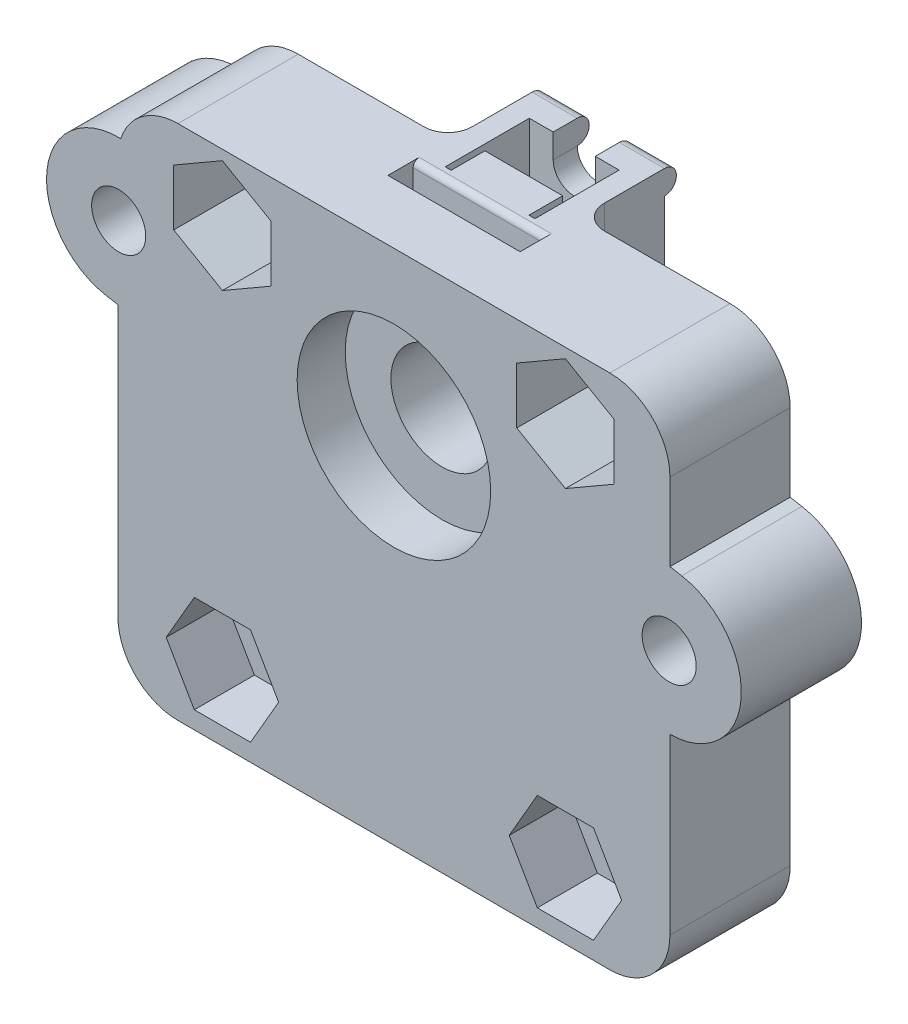
from build123d import *

# Parameters (mm, degrees)
BOSS_EXTRUDE1_DEPTH      = 13.5
BOSS_EXTRUDE2_DEPTH      = 18.5
BOSS_EXTRUDE3_DEPTH      = 5
SKETCH4_W                = 45.922011884
SKETCH4_H                = 20
BOSS_EXTRUDE4_DEPTH      = 13.5
SKETCH2_R                = 4.25
CUT_EXTRUDE1_DEPTH       = 268.629329099
SKETCH6_R                = 8.05
CUT_EXTRUDE3_DEPTH       = 14
BOSS_EXTRUDE5_DEPTH      = 13.5
CUT_EXTRUDE5_REACH       = 210.1
CUT_EXTRUDE5_END_RADIUS  = 45
SKETCH8_R                = 9
CUT_EXTRUDE6_REACH       = 210.1
SKETCH10_R               = 4
SKETCH11_R               = 8
CUT_EXTRUDE7_DEPTH       = 4
SKETCH18_R               = 11
CUT_EXTRUDE9_DEPTH       = 47
CUT_EXTRUDE11_DEPTH      = 268.629329099
CUT_EXTRUDE11_DEPTH_BACK = 268.629329099
SKETCH20_W               = 45.922011884
SKETCH20_H               = 204.425421037
SKETCH21_W               = 45.922011884
SKETCH21_H               = 10
BOSS_EXTRUDE6_DEPTH      = 16
M5_CLEARANCE_HOLE1_D     = 5.5
CUT_EXTRUDE12_DEPTH      = 5
LPATTERN2_COUNT          = 2
LPATTERN2_PITCH          = 32
LPATTERN2_COPY_1_D       = 5.5
CUT_EXTRUDE13_START      = -4
SKETCH25_R               = 2.75
CUT_EXTRUDE13_DEPTH      = 39.396436099
SKETCH26_W               = 45.922011884
SKETCH26_H               = 10
CUT_EXTRUDE14_DEPTH      = 271.429672547
FILLET1_R                = 5
SKETCH30_W               = 11
SKETCH30_H               = 7
BOSS_EXTRUDE8_DEPTH      = 5
CUT_EXTRUDE15_DEPTH      = 5
FILLET3_R                = 2
BOSS_EXTRUDE9_DEPTH      = 2
BOSS_EXTRUDE10_DEPTH     = 3.75
SKETCH36_W               = 11
SKETCH36_H               = 2.1
CUT_EXTRUDE17_DEPTH      = 2.5
FILLET4_R                = 0.5
BOSS_EXTRUDE11_START     = -10
BOSS_EXTRUDE11_DEPTH     = 10
CUT_EXTRUDE18_DEPTH      = 4
M4_CLEARANCE_HOLE1_D     = 4.5


with BuildPart() as part:
    # Sketch1 → Boss-Extrude1 (new, symmetric)
    with BuildSketch(Plane(origin=(0, 0, 0), x_dir=(1, 0, 0), z_dir=(0, 1, 0))):
        with BuildLine():
            ThreePointArc((17.220754456, -41.574578963), (0, -45), (-17.220754456, -41.574578963))
            Line((-17.220754456, -41.574578963), (-22.961005942, -55.432771951))
            ThreePointArc((-22.961005942, -55.432771951), (0, -60), (22.961005942, -55.432771951))
            Line((22.961005942, -55.432771951), (17.220754456, -41.574578963))
        make_face()
    extrude(amount=BOSS_EXTRUDE1_DEPTH, both=True)

    # Sketch1<3> → Boss-Extrude2 (add, symmetric)
    with BuildSketch(Plane(origin=(0, 0, 0), x_dir=(1, 0, 0), z_dir=(0, 1, 0))):
        with BuildLine():
            ThreePointArc((19.134171618, -46.193976626), (0, -50), (-19.134171618, -46.193976626))
            Line((-19.134171618, -46.193976626), (-21.04758878, -50.813374288))
            ThreePointArc((-21.04758878, -50.813374288), (0, -55), (21.04758878, -50.813374288))
            Line((21.04758878, -50.813374288), (19.134171618, -46.193976626))
        make_face()
    extrude(amount=BOSS_EXTRUDE2_DEPTH, both=True)

    # Sketch3 → Boss-Extrude3 (add, symmetric)
    with BuildSketch(Plane.XZ):
        with BuildLine():
            Line((-22.961005942, 266), (-22.961005942, 55.432771951))
            ThreePointArc((-22.961005942, 55.432771951), (-20.481139434, 56.39612511), (-17.961005942, 57.248600555))
            Line((-17.961005942, 57.248600555), (-17.961005942, 246))
            Line((-17.961005942, 246), (17.961005942, 246))
            Line((17.961005942, 246), (17.961005942, 57.248600555))
            ThreePointArc((17.961005942, 57.248600555), (20.481139434, 56.39612511), (22.961005942, 55.432771951))
            Line((22.961005942, 55.432771951), (22.961005942, 266))
            Line((22.961005942, 266), (-22.961005942, 266))
        make_face()
    extrude(amount=BOSS_EXTRUDE3_DEPTH, both=True)

    # Sketch4 → Boss-Extrude4 (add, symmetric)
    with BuildSketch(Plane(origin=(0, 0, 0), x_dir=(1, 0, 0), z_dir=(0, 1, 0))):
        with Locations((0, -256)):
            Rectangle(SKETCH4_W, SKETCH4_H)
    extrude(amount=BOSS_EXTRUDE4_DEPTH, both=True)

    # Sketch2 → Cut-Extrude1 (cut, through all)
    with BuildSketch(Plane.XY):
        with Locations(Location((0, 0, 0), (0, 0, 180))):
            Circle(SKETCH2_R)
    extrude(amount=CUT_EXTRUDE1_DEPTH, mode=Mode.SUBTRACT)

    # Sketch6 → Cut-Extrude3 (cut)
    with BuildSketch(Plane.XY.offset(266)):
        Circle(SKETCH6_R)
    extrude(amount=-CUT_EXTRUDE3_DEPTH, mode=Mode.SUBTRACT)

    # Sketch9 → Boss-Extrude5 (add, symmetric)
    with BuildSketch(Plane(origin=(0, 0, 0), x_dir=(1, 0, 0), z_dir=(0, 1, 0))):
        with BuildLine():
            Line((-22.961005942, -55.432771951), (-22.961005942, -68))
            Line((-22.961005942, -68), (22.961005942, -68))
            Line((22.961005942, -68), (22.961005942, -55.432771951))
            ThreePointArc((22.961005942, -55.432771951), (0, -60), (-22.961005942, -55.432771951))
        make_face()
    extrude(amount=BOSS_EXTRUDE5_DEPTH, both=True)

    # Cut-Extrude5: up to this cylinder (the profile starts outside it)
    cut_extrude5_end = Plane(origin=(0, 0, 0), z_dir=(0, -1, 0)) * Cylinder(CUT_EXTRUDE5_END_RADIUS, 511.2, mode=Mode.PRIVATE)
    # Sketch8 → Cut-Extrude5 (cut, up to the surface)
    with BuildSketch(Plane.XY.offset(60), mode=Mode.PRIVATE) as cut_extrude5_sk1:
        Circle(SKETCH8_R)
    cut_extrude5_tool1 = extrude(cut_extrude5_sk1.sketch, amount=-CUT_EXTRUDE5_REACH, mode=Mode.PRIVATE) - cut_extrude5_end
    add(cut_extrude5_tool1.solids().sort_by_distance((0, 0, 60))[0], mode=Mode.SUBTRACT)

    # Sketch10 → Cut-Extrude6 (cut, up to next)
    with BuildSketch(Plane.XY.offset(60), mode=Mode.PRIVATE) as cut_extrude6_sk1:
        with Locations(Location((0, 0, 0), (0, 0, 180))):
            Circle(SKETCH10_R)
    cut_extrude6_tool1 = extrude(cut_extrude6_sk1.sketch, amount=CUT_EXTRUDE6_REACH, mode=Mode.PRIVATE) & part.part
    add(cut_extrude6_tool1.solids().sort_by_distance((0, 0, 60))[0], mode=Mode.SUBTRACT)

    # Sketch11 → Cut-Extrude7 (cut)
    with BuildSketch(Plane.XY.offset(68)):
        Circle(SKETCH11_R)
    extrude(amount=-CUT_EXTRUDE7_DEPTH, mode=Mode.SUBTRACT)

    # Sketch18 → Cut-Extrude9 (cut)
    with BuildSketch(Plane.XY):
        with Locations(Location((0, 0, 0), (0, 0, 180))):
            Circle(SKETCH18_R)
    extrude(amount=CUT_EXTRUDE9_DEPTH, mode=Mode.SUBTRACT)

    # Sketch20 → Cut-Extrude11 (cut, two sides: drawn at the far end of the back side and taken through both)
    with BuildSketch(Plane(origin=(0, 0, 0), x_dir=(1, 0, 0), z_dir=(0, 1, 0)).offset(-CUT_EXTRUDE11_DEPTH_BACK)):
        with Locations((0, -143.787289482)):
            Rectangle(SKETCH20_W, SKETCH20_H)
    extrude(amount=CUT_EXTRUDE11_DEPTH + CUT_EXTRUDE11_DEPTH_BACK, mode=Mode.SUBTRACT)

    # Sketch21 → Boss-Extrude6 (add)
    with BuildSketch(Plane.XZ.offset(13.5)):
        with Locations((0, 251)):
            Rectangle(SKETCH21_W, SKETCH21_H)
    extrude(amount=BOSS_EXTRUDE6_DEPTH)

    # M5 Clearance Hole1 (through all)
    with Locations(Plane(origin=(0, 0, 246), x_dir=(-1, 0, 0), z_dir=(0, 0, -1))):
        with Locations((-14.26606865, -24)):
            m5_clearance_hole1 = Hole(M5_CLEARANCE_HOLE1_D / 2)

    # Sketch24 → Cut-Extrude12 (cut)
    with BuildSketch(Plane.XY.offset(256)):
        Polygon((18.94260583, -24), (16.60433724, -19.95), (11.92780006, -19.95), (9.58953147, -24), (11.92780006, -28.05), (16.60433724, -28.05), align=None)
    cut_extrude12 = extrude(amount=-CUT_EXTRUDE12_DEPTH, mode=Mode.SUBTRACT)

    # Mirror1: M5 Clearance Hole1 across plane
    add(m5_clearance_hole1.mirror(Plane(origin=(0, 0, 0), x_dir=(0, 0, 1), z_dir=(1, 0, 0))), mode=Mode.SUBTRACT)

    # Mirror2: Cut-Extrude12 across plane
    add(cut_extrude12.mirror(Plane(origin=(0, 0, 0), x_dir=(0, 0, 1), z_dir=(1, 0, 0))), mode=Mode.SUBTRACT)

    # LPattern2: M5 Clearance Hole1 ×2
    with Locations(*[(0, i * LPATTERN2_PITCH, 0) for i in range(1, LPATTERN2_COUNT)]):
        add(m5_clearance_hole1, mode=Mode.SUBTRACT)

    # LPattern2 copy 1 (through all)
    with Locations(Plane(origin=(0, 32, 246), x_dir=(1, 0, 0), z_dir=(0, 0, -1))):
        with Locations((-14.26606865, 24)):
            Hole(LPATTERN2_COPY_1_D / 2)

    # Sketch25 → Cut-Extrude13 (cut, through all)
    # profile 1 of 2: a face of its own
    with BuildSketch(Plane(origin=(0, 0, 246), x_dir=(-1, 0, 0), z_dir=(0, 0, -1)).offset(CUT_EXTRUDE13_START)):
        Polygon((-10.21606865, 10.33826859), (-14.26606865, 12.67653718), (-18.31606865, 10.33826859), (-18.31606865, 5.66173141), (-14.26606865, 3.32346282), (-10.21606865, 5.66173141), align=None)
        with Locations((-14.26606865, 8)):
            Circle(SKETCH25_R, mode=Mode.SUBTRACT)
    # profile 2 of 2: a face of its own
    with BuildSketch(Plane(origin=(0, 0, 246), x_dir=(-1, 0, 0), z_dir=(0, 0, -1)).offset(CUT_EXTRUDE13_START)):
        with Locations((-14.26606865, 8)):
            Circle(SKETCH25_R)
    cut_extrude13 = extrude(amount=-CUT_EXTRUDE13_DEPTH, mode=Mode.SUBTRACT)

    # Mirror3: Cut-Extrude13 across plane
    add(cut_extrude13.mirror(Plane(origin=(0, 0, 0), x_dir=(0, 0, 1), z_dir=(1, 0, 0))), mode=Mode.SUBTRACT)

    # Sketch26 → Cut-Extrude14 (cut, through all)
    with BuildSketch(Plane(origin=(0, 13.5, 0), x_dir=(1, 0, 0), z_dir=(0, 1, 0))):
        with Locations((0, -261)):
            Rectangle(SKETCH26_W, SKETCH26_H)
    extrude(amount=-CUT_EXTRUDE14_DEPTH, mode=Mode.SUBTRACT)

    # Fillet1
    fillet1_edges = [part.edges().sort_by_distance(p)[0] for p in [
        (-22.961005942, -29.5, 251),
        (22.961005942, -29.5, 251),
        (22.961005942, 13.5, 251),
        (-22.961005942, 13.5, 251),
    ]]
    fillet(fillet1_edges, radius=FILLET1_R)

    # Sketch30 → Boss-Extrude8 (add)
    with BuildSketch(Plane(origin=(0, 0, 246), x_dir=(-1, 0, 0), z_dir=(0, 0, -1))):
        with Locations((0, 10)):
            Rectangle(SKETCH30_W, SKETCH30_H)
    extrude(amount=BOSS_EXTRUDE8_DEPTH)

    # Sketch31 → Cut-Extrude15 (cut)
    with BuildSketch(Plane(origin=(0, 13.5, 0), x_dir=(1, 0, 0), z_dir=(0, 1, 0))):
        Polygon((3.735, -241), (3.735, -248), (3.235, -248), (3.235, -245.2), (-3.235, -245.2), (-3.235, -248), (-3.735, -248), (-3.735, -241), align=None)
    extrude(amount=-CUT_EXTRUDE15_DEPTH, mode=Mode.SUBTRACT)

    # Fillet3
    fillet3_edges = [part.edges().sort_by_distance(p)[0] for p in [
        (-5.5, 10, 246),
        (5.5, 10, 246),
        (0, 6.5, 246),
    ]]
    fillet(fillet3_edges, radius=FILLET3_R)

    # Sketch32 → Boss-Extrude9 (add)
    with BuildSketch(Plane(origin=(0, 0, 241), x_dir=(-1, 0, 0), z_dir=(0, 0, -1))):
        Polygon((3.735, 13.5), (3.735, 8.5), (-3.735, 8.5), (-3.735, 13.5), (-5.5, 13.5), (-5.5, 6.5), (5.5, 6.5), (5.5, 13.5), align=None)
        with BuildLine():
            ThreePointArc((1.75, 11.5), (0, 9.75), (-1.75, 11.5))
            Line((-1.75, 11.5), (-1.75, 13.5))
            Line((-1.75, 13.5), (-3.735, 13.5))
            Line((-3.735, 13.5), (-3.735, 8.5))
            Line((-3.735, 8.5), (3.735, 8.5))
            Line((3.735, 8.5), (3.735, 13.5))
            Line((3.735, 13.5), (1.75, 13.5))
            Line((1.75, 13.5), (1.75, 11.5))
        make_face()
    extrude(amount=BOSS_EXTRUDE9_DEPTH)

    # Sketch34 → Boss-Extrude10 (add)
    with BuildSketch(Plane.ZY.offset(5.5)):
        with BuildLine():
            Line((239, 13.5), (239, 11.5))
            ThreePointArc((239, 11.5), (238, 12.5), (239, 13.5))
        make_face()
    boss_extrude10 = extrude(amount=-BOSS_EXTRUDE10_DEPTH)

    # Mirror5: Boss-Extrude10 across plane
    add(boss_extrude10.mirror(Plane(origin=(0, 0, 0), x_dir=(0, 0, 1), z_dir=(1, 0, 0))))

    # Sketch36 → Cut-Extrude17 (cut)
    with BuildSketch(Plane(origin=(0, 13.5, 0), x_dir=(1, 0, 0), z_dir=(0, 1, 0))):
        with Locations((0, -249.95)):
            Rectangle(SKETCH36_W, SKETCH36_H)
    extrude(amount=-CUT_EXTRUDE17_DEPTH, mode=Mode.SUBTRACT)

    # Fillet4
    fillet4_edges = [part.edges().sort_by_distance(p)[0] for p in [
        (0, 13.5, 248.9),
    ]]
    fillet(fillet4_edges, radius=FILLET4_R)

    # Sketch38 → Boss-Extrude11 (add)
    with BuildSketch(Plane.XY.offset(256).offset(BOSS_EXTRUDE11_START)):
        with BuildLine():
            Line((23.938669324, 1.871526387), (22.961005942, 2.04391482))
            Line((22.961005942, 2.04391482), (22.961005942, -10.036976376))
            ThreePointArc((22.961005942, -10.036976376), (28.876661693, -4.528255996), (23.938669324, 1.871526387))
        make_face()
        with BuildLine():
            ThreePointArc((-22.961005942, 8.5), (-22.900298084, 9.276783841), (-22.719648688, 10.034704928))
            ThreePointArc((-22.719648688, 10.034704928), (-28.86557724, 4.648435983), (-23.938669324, -1.871526387))
            Line((-23.938669324, -1.871526387), (-22.961005942, -2.04391482))
            Line((-22.961005942, -2.04391482), (-22.961005942, 8.5))
        make_face()
    extrude(amount=BOSS_EXTRUDE11_DEPTH)

    # Sketch39 → Cut-Extrude18 (cut)
    with BuildSketch(Plane(origin=(0, 0, 246), x_dir=(-1, 0, 0), z_dir=(0, 0, -1))):
        Polygon((-22.896780258, -8.107639529), (-19.371780258, -6.07247983), (-19.371780258, -2.002160432), (-22.896780258, 0.032999267), (-26.421780258, -2.002160432), (-26.421780258, -6.07247983), align=None)
        Polygon((18.894288787, 3.29734579), (21.536371099, 0.201073668), (25.53886257, 0.941048009), (26.899271729, 4.777294471), (24.257189416, 7.873566593), (20.254697945, 7.133592253), align=None)
    extrude(amount=-CUT_EXTRUDE18_DEPTH, mode=Mode.SUBTRACT)

    # M4 Clearance Hole1 (through all)
    with Locations(Plane.XY.offset(256)):
        with Locations((-22.896780258, 4.037320131), (22.896780258, -4.037320131)):
            Hole(M4_CLEARANCE_HOLE1_D / 2)


solid = part.part
